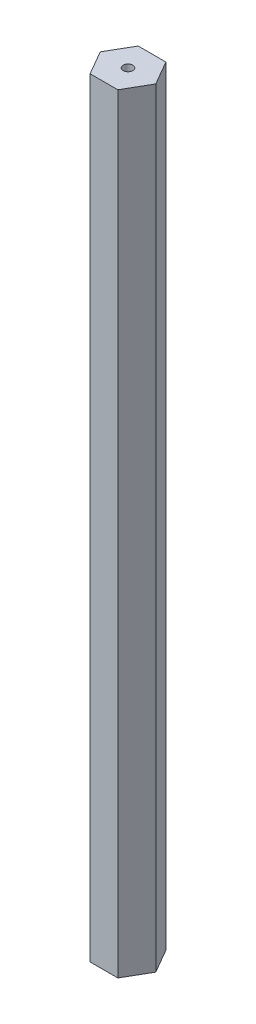
from build123d import *

# Parameters (mm, degrees)
SKETCH1_R           = 1.27
BOSS_EXTRUDE1_DEPTH = 203.2


with BuildPart() as part:
    # Sketch1 → Boss-Extrude1 (new body)
    with BuildSketch(Plane(origin=(0, 0, 0), x_dir=(1, 0, 0), z_dir=(0, 1, 0))):
        Polygon((7.332348419, 0), (3.666174209, 6.35), (-3.666174209, 6.35), (-7.332348419, 0), (-3.666174209, -6.35), (3.666174209, -6.35), align=None)
        with Locations(Location((0, 0, 0), (0, 0, 270))):
            Circle(SKETCH1_R, mode=Mode.SUBTRACT)
    extrude(amount=BOSS_EXTRUDE1_DEPTH)


solid = part.part
